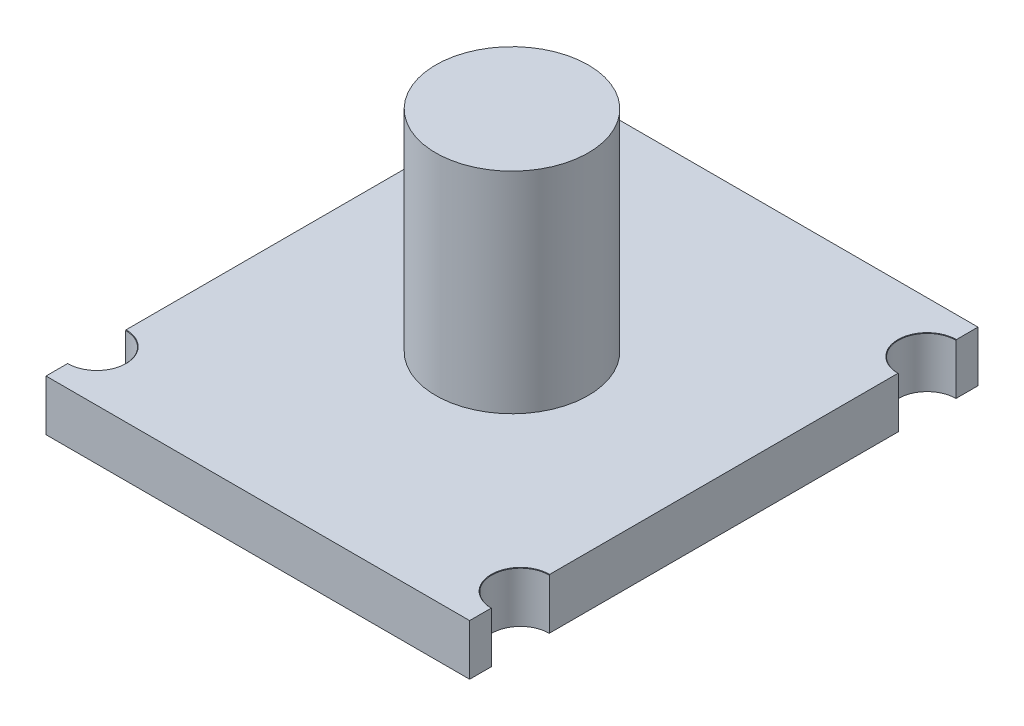
from build123d import *

# Parameters (mm, degrees)
SKETCH1_W                      = 25
SKETCH1_H                      = 30
BOSS_EXTRUDE1_DEPTH            = 3
M3_CLEARANCE_HOLE1_D           = 3.4
M3_CLEARANCE_HOLE1_CSINK_D     = 3.45
M3_CLEARANCE_HOLE1_CSINK_ANGLE = 90
SKETCH4_R                      = 4.5
BOSS_EXTRUDE2_DEPTH            = 12.4
SKETCH5_W                      = 6
SKETCH5_H                      = 12
BOSS_EXTRUDE3_DEPTH            = 6


with BuildPart() as part:
    # Sketch1 → Boss-Extrude1 (new body)
    with BuildSketch(Plane(origin=(0, 0, 0), x_dir=(1, 0, 0), z_dir=(0, 1, 0))):
        with Locations((12.5, 15)):
            Rectangle(SKETCH1_W, SKETCH1_H)
    extrude(amount=BOSS_EXTRUDE1_DEPTH)

    # M3 Clearance Hole1 (through all)
    with Locations(Plane(origin=(0, 3, 0), x_dir=(1, 0, 0), z_dir=(0, 1, 0))):
        with Locations((0, 3), (0, 27), (25, 3), (25, 27)):
            CounterSinkHole(M3_CLEARANCE_HOLE1_D / 2, M3_CLEARANCE_HOLE1_CSINK_D / 2, counter_sink_angle=M3_CLEARANCE_HOLE1_CSINK_ANGLE)

    # Sketch4 → Boss-Extrude2 (add)
    with BuildSketch(Plane(origin=(0, 3, 0), x_dir=(1, 0, 0), z_dir=(0, 1, 0))):
        with Locations(Location((12.5, 15, 0), (0, 0, 90))):
            Circle(SKETCH4_R)
    extrude(amount=BOSS_EXTRUDE2_DEPTH)

    # Sketch5 → Boss-Extrude3 (add)
    with BuildSketch(Plane.XZ):
        with Locations((3, -15)):
            Rectangle(SKETCH5_W, SKETCH5_H)
    extrude(amount=BOSS_EXTRUDE3_DEPTH)


solid = part.part
